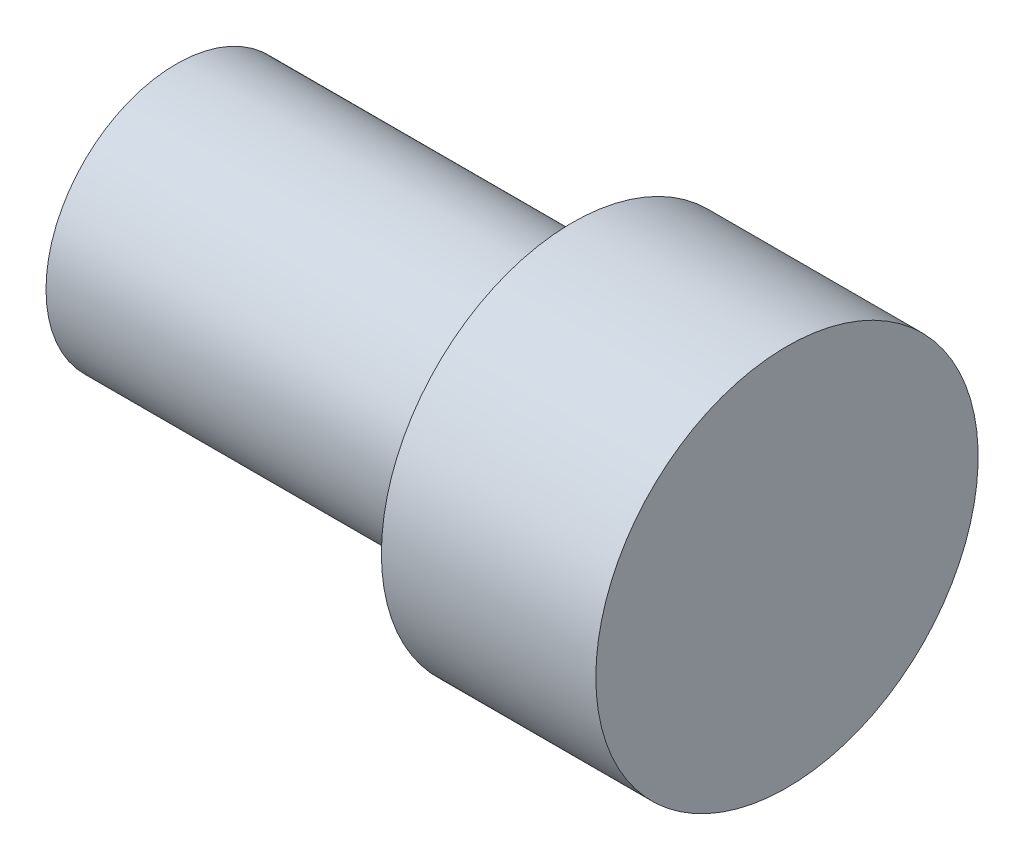
from build123d import *


with BuildPart() as part:
    # Esquisse2 → Révolution1 (revolve)
    with BuildSketch(Plane.XY, mode=Mode.PRIVATE) as r_volution1_sk:
        Polygon((-65.915949464, 0), (-65.915949464, 28.059633533), (19.472418098, 28.059633533), (19.472418098, 41.188623293), (65.674056071, 41.188623293), (65.674056071, 0), align=None)
    revolve(r_volution1_sk.sketch.rotate(Axis((-65.915949464, 0, 0), (1, 0, 0)), 90), axis=Axis((-65.915949464, 0, 0), (1, 0, 0)))


solid = part.part
